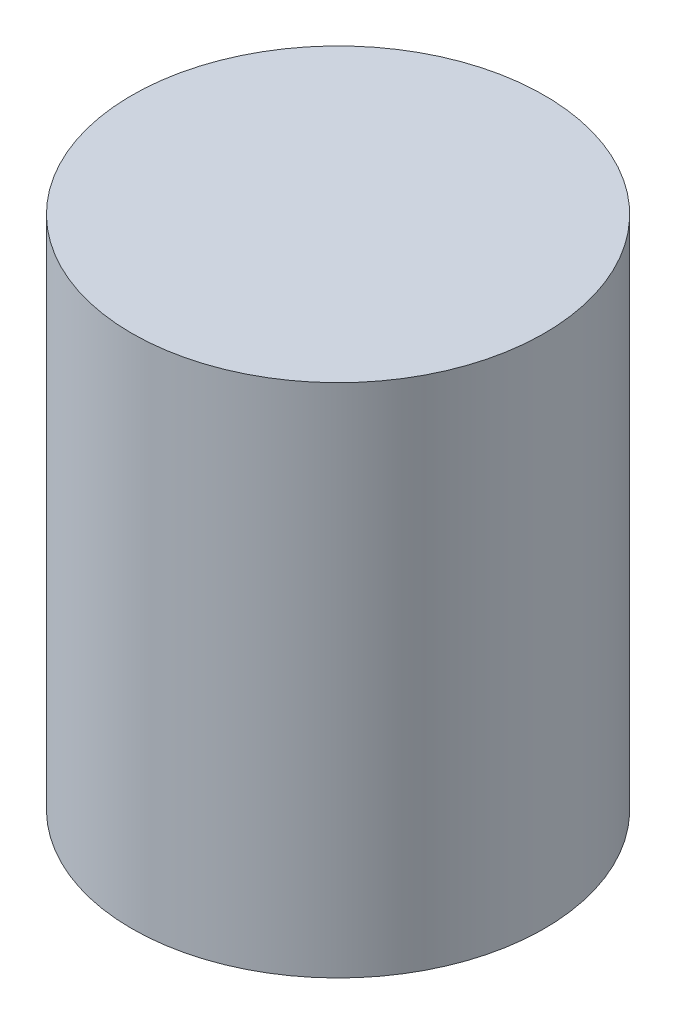
from build123d import *

# Parameters (mm, degrees)
SKETCH1_W = 40
SKETCH1_H = 100


with BuildPart() as part:
    # Sketch1 → Revolve1 (revolve)
    with BuildSketch(Plane.XY, mode=Mode.PRIVATE) as revolve1_sk:
        with Locations((20, 0.654205607)):
            Rectangle(SKETCH1_W, SKETCH1_H)
    revolve(revolve1_sk.sketch.rotate(Axis((0, 50.654205607, 0), (0, -1, 0)), 90), axis=Axis((0, 50.654205607, 0), (0, -1, 0)))


solid = part.part
